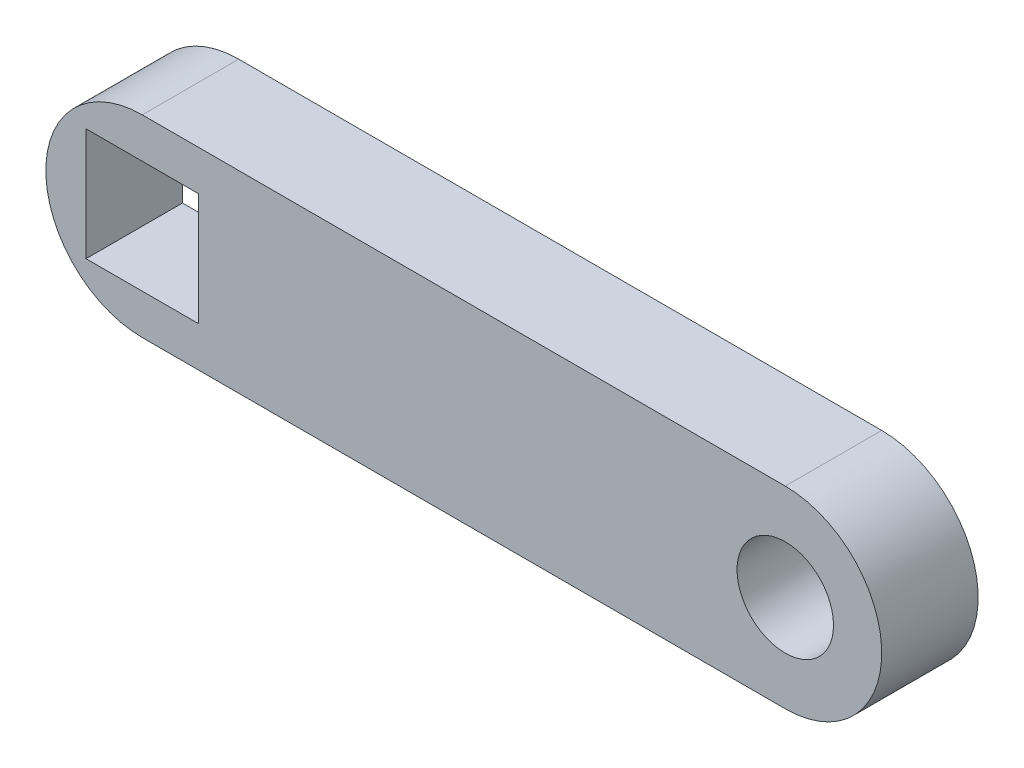
from build123d import *

# Parameters (mm, degrees)
ESQUISSE1_R        = 1.5
ESQUISSE1_W        = 3.5
ESQUISSE1_H        = 3.5
BOSS_EXTRU_1_DEPTH = 3


with BuildPart() as part:
    # Esquisse1 → Boss.-Extru.1 (new body)
    with BuildSketch(Plane.XY):
        with BuildLine():
            Line((0, 3), (20, 3))
            ThreePointArc((20, 3), (23, 0), (20, -3))
            Line((20, -3), (0, -3))
            ThreePointArc((0, -3), (-3, 0), (0, 3))
        make_face()
        with Locations((20, 0)):
            Circle(ESQUISSE1_R, mode=Mode.SUBTRACT)
        Rectangle(ESQUISSE1_W, ESQUISSE1_H, mode=Mode.SUBTRACT)
    extrude(amount=BOSS_EXTRU_1_DEPTH)


solid = part.part
